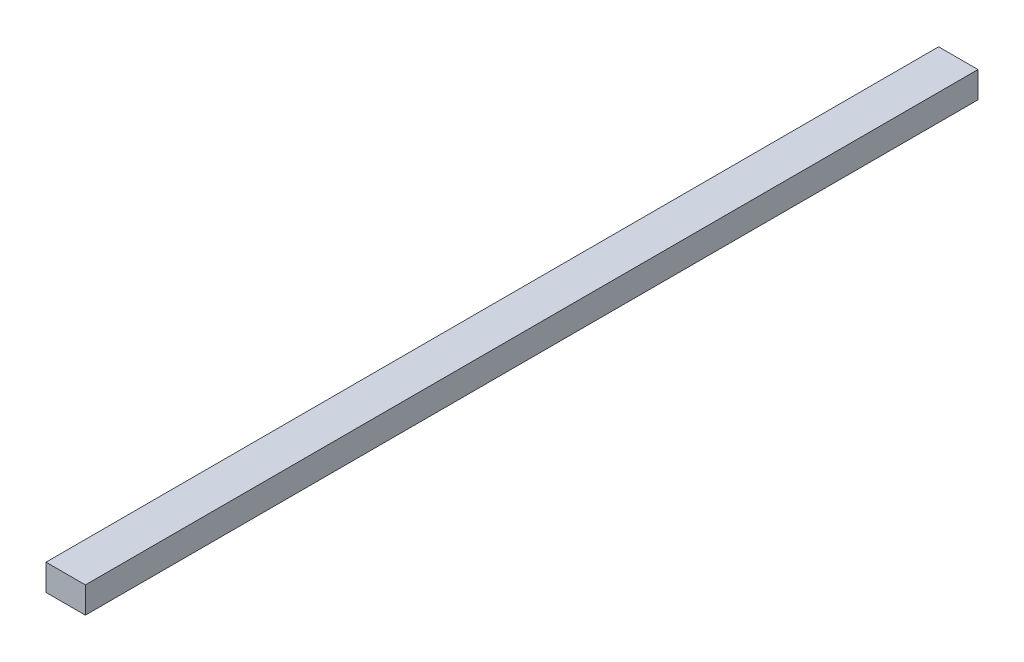
from build123d import *

# Parameters (mm, degrees)
KAPYAG_KIZAK_SAG_30X20_1_START = -20
SKETCH1_W                      = 30
SKETCH1_H                      = 20
KAPYAG_KIZAK_SAG_30X20_1_DEPTH = 680


with BuildPart() as part:
    # Sketch1 → KAPYAG_kizak_sag_30x20_1 (new body)
    with BuildSketch(Plane.XY.offset(KAPYAG_KIZAK_SAG_30X20_1_START)):
        with Locations((50, 10)):
            Rectangle(SKETCH1_W, SKETCH1_H)
    extrude(amount=-KAPYAG_KIZAK_SAG_30X20_1_DEPTH)


solid = part.part
